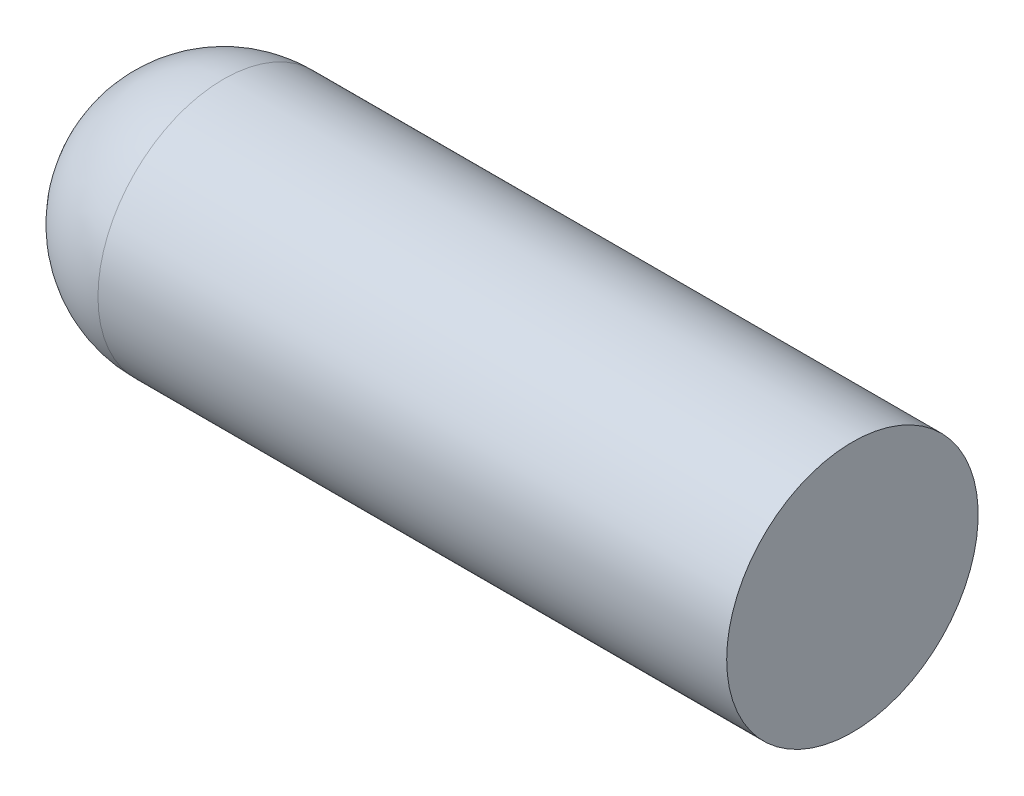
from build123d import *


with BuildPart() as part:
    # Sketch8 → Revolve8 (revolve)
    with BuildSketch(Plane.XY):
        with BuildLine():
            Line((508, 0), (0, 0))
            add(Edge.make_bspline(
                [(0, 0), (0.002822011, 0.011220682), (0.01010376, 0.033028979), (0.031502321, 0.074017024), (0.069784833, 0.131646678), (0.119222388, 0.195375451), (0.189812425, 0.276067496), (0.274835356, 0.363880791), (0.401947452, 0.484306453), (0.602624186, 0.656685654), (0.914446886, 0.898448081), (1.444794417, 1.267055392), (2.342189308, 1.821854316), (3.926219982, 2.68636524), (6.792153336, 4.05339861), (11.891147147, 6.162529219), (20.431057711, 9.216107653), (31.891623295, 12.776951203), (45.625686568, 16.59500746), (64.715206078, 21.439103902), (87.842839522, 26.755548696), (115.260857413, 32.475768916), (146.98211669, 38.485522007), (178.789638074, 44.017933119), (210.666331669, 49.135593448), (242.60094075, 53.877496918), (274.585932559, 58.26635678), (306.615943821, 62.313330004), (338.687218842, 66.019317565), (370.797101622, 69.374815155), (402.943853119, 72.357821551), (431.103668314, 74.606208089), (455.262955994, 76.229190957), (474.443672775, 77.278006717), (487.103143355, 77.83586579), (497.267203511, 78.174386426), (503.399758723, 78.310011701), (506.466506539, 78.353386553), (508, 78.359)],
                knots=[0, 0, 0, 0, 0, 8.9262e-05, 0.000178524, 0.000357048, 0.000535573, 0.000714097, 0.001009141, 0.001304186, 0.001892408, 0.002763912, 0.00406622, 0.006308364, 0.010066681, 0.016745451, 0.028667746, 0.049062689, 0.080343506, 0.109747473, 0.13915144, 0.201713099, 0.264274768, 0.326836438, 0.389398105, 0.451959776, 0.514521446, 0.577083113, 0.639644785, 0.702206453, 0.764768123, 0.827329793, 0.889891462, 0.921172297, 0.952453131, 0.976226566, 0.988113283, 1, 1, 1, 1, 1], degree=4))
            Line((508, 78.359), (762, 78.359))
            Line((762, 78.359), (1524, 78.359))
            Line((1524, 78.359), (1524, 0))
            Line((1524, 0), (762, 0))
            Line((762, 0), (508, 0))
        make_face()
    revolve(axis=Axis((508, 0, 0), (-1, 0, 0)))


with BuildPart() as body_2:
    # Sketch9 → Revolve9 (revolve)
    with BuildSketch(Plane.XY):
        with BuildLine():
            Line((-1524, 0), (7620.000077199, 0))
            Line((7620.000077199, 0), (7620.000077199, 1524))
            Line((7620.000077199, 1524), (7.7199e-05, 1524))
            ThreePointArc((7.7199e-05, 1524), (-1077.630707234, 1077.630761822), (-1524, 0))
        make_face()
    revolve(axis=Axis((-1524, 0, 0), (1, 0, 0)))

    # Combine1: cut part
    add(part.part, mode=Mode.SUBTRACT)


solid = body_2.part
